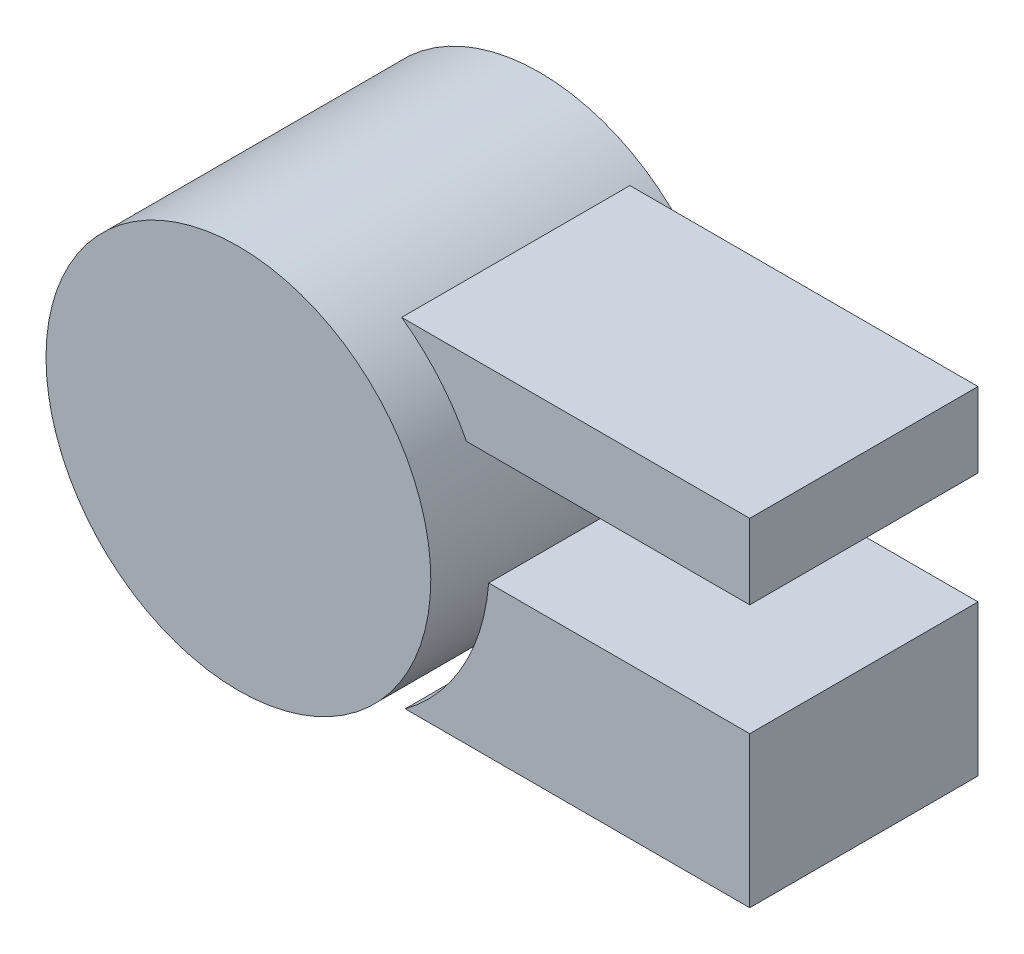
from build123d import *

# Parameters (mm, degrees)
SKETCH1_R                = 76.09074969
BOSS_EXTRUDE1_DEPTH      = 59.563
BOSS_EXTRUDE2_REACH      = 280.793
BOSS_EXTRUDE2_END_RADIUS = 82.44074969
SKETCH2_W                = 90.285613873
SKETCH2_H                = 59.622575199
SKETCH2_H_2              = 29.640937385


with BuildPart() as part:
    # Sketch1 → Boss-Extrude1 (new, symmetric)
    with BuildSketch(Plane.XY):
        Circle(SKETCH1_R)
    extrude(amount=BOSS_EXTRUDE1_DEPTH, both=True)


with BuildPart() as body_2:
    # Boss-Extrude2: up to this cylinder (the profile starts outside it)
    boss_extrude2_end = Plane(origin=(0, 0, -2.384903), z_dir=(0, 0, -1)) * Cylinder(BOSS_EXTRUDE2_END_RADIUS, 727.467499381, mode=Mode.PRIVATE)
    # Sketch2 → Boss-Extrude2 (new, up to the surface)
    with BuildSketch(Plane(origin=(185.42, 0, 0), x_dir=(0, 0, -1), z_dir=(1, 0, 0)), mode=Mode.PRIVATE) as boss_extrude2_sk1:
        with Locations((2.384903008, -36.369770872)):
            Rectangle(SKETCH2_W, SKETCH2_H)
    boss_extrude2_tool1 = extrude(boss_extrude2_sk1.sketch, amount=-BOSS_EXTRUDE2_REACH, mode=Mode.PRIVATE) - boss_extrude2_end
    add(boss_extrude2_tool1.solids().sort_by_distance((185.42, -36.369771, -2.384903))[0])
    # Sketch2 → Boss-Extrude2 (new, up to the surface)
    with BuildSketch(Plane(origin=(185.42, 0, 0), x_dir=(0, 0, -1), z_dir=(1, 0, 0)), mode=Mode.PRIVATE) as boss_extrude2_sk2:
        with Locations((2.384903008, 52.382691068)):
            Rectangle(SKETCH2_W, SKETCH2_H_2)
    boss_extrude2_tool2 = extrude(boss_extrude2_sk2.sketch, amount=-BOSS_EXTRUDE2_REACH, mode=Mode.PRIVATE) - boss_extrude2_end
    add(boss_extrude2_tool2.solids().sort_by_distance((185.42, 52.382691, -2.384903))[0])


solid = Compound([part.part, body_2.part])
